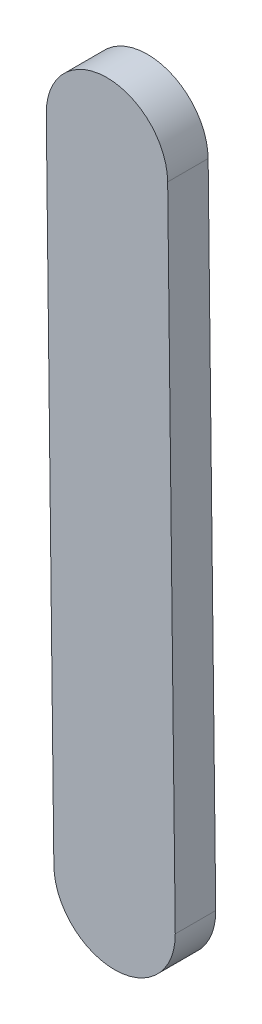
from build123d import *

# Parameters (mm, degrees)
EXTRUDE_1_DEPTH = 1


with BuildPart() as part:
    # 草图1 → 凸台-拉伸1 (new body)
    with BuildSketch(Plane.XY):
        with BuildLine():
            Line((-29.784291412, 61.483800789), (-29.596804285, 45.484899309))
            ThreePointArc((-29.596804285, 45.484899309), (-31.079124381, 43.967425377), (-32.596598312, 45.449745473))
            Line((-32.596598312, 45.449745473), (-32.784085439, 61.448646953))
            ThreePointArc((-32.784085439, 61.448646953), (-31.301765344, 62.966120885), (-29.784291412, 61.483800789))
        make_face()
    extrude(amount=EXTRUDE_1_DEPTH)


solid = part.part
